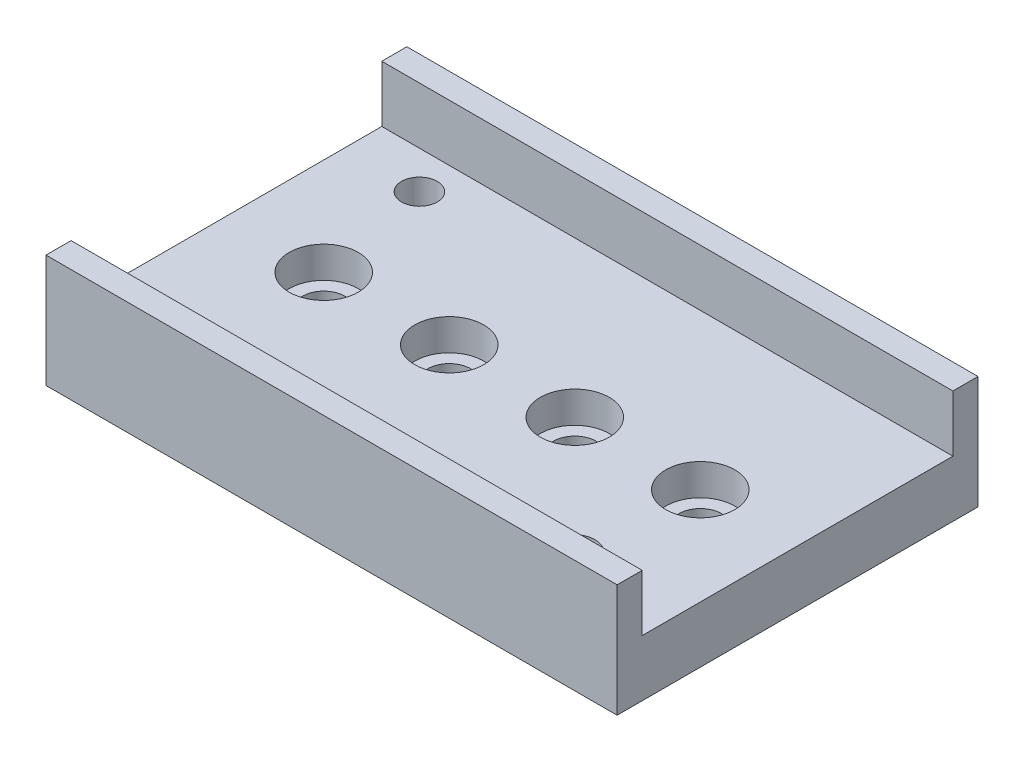
from build123d import *

# Parameters (mm, degrees)
SKETCH1_W           = 45.5
SKETCH1_H           = 28.75
SKETCH1_R           = 1.7
BOSS_EXTRUDE1_DEPTH = 2
BOSS_EXTRUDE2_DEPTH = 7
SKETCH3_W           = 45.5
SKETCH3_H           = 8
SKETCH3_R           = 1.425
SKETCH3_R_2         = 1.685028189
BOSS_EXTRUDE3_DEPTH = 2.5
CUT_EXTRUDE1_REACH  = 29.807


with BuildPart() as part:
    # Sketch1 → Boss-Extrude1 (new body)
    with BuildSketch(Plane(origin=(0, 0, 0), x_dir=(1, 0, 0), z_dir=(0, 1, 0))):
        Rectangle(SKETCH1_W, SKETCH1_H)
        with Locations(Location((-15, 0, 0), (0, 0, 270))):
            Circle(SKETCH1_R, mode=Mode.SUBTRACT)
        with Locations(Location((-5, 0, 0), (0, 0, 270))):
            Circle(SKETCH1_R, mode=Mode.SUBTRACT)
        with Locations(Location((5, 0, 0), (0, 0, 270))):
            Circle(SKETCH1_R, mode=Mode.SUBTRACT)
        with Locations(Location((15, 0, 0), (0, 0, 270))):
            Circle(SKETCH1_R, mode=Mode.SUBTRACT)
    extrude(amount=BOSS_EXTRUDE1_DEPTH)

    # Sketch2 → Boss-Extrude2 (add)
    with BuildSketch(Plane(origin=(0, 2, 0), x_dir=(1, 0, 0), z_dir=(0, 1, 0))):
        Polygon((-22.75, 14.375), (22.75, 14.375), (22.75, 12.375), (20.75, 12.375), (-20.75, 12.375), (-22.75, 12.375), align=None)
        Polygon((-22.75, -14.375), (22.75, -14.375), (22.75, -12.375), (20.75, -12.375), (-20.75, -12.375), (-22.75, -12.375), align=None)
    extrude(amount=BOSS_EXTRUDE2_DEPTH)

    # Sketch3 → Boss-Extrude3 (add)
    # profile 1 of 4: a face of its own
    with BuildSketch(Plane(origin=(0, 2, 0), x_dir=(1, 0, 0), z_dir=(0, 1, 0))):
        with Locations((0, 8.375)):
            Rectangle(SKETCH3_W, SKETCH3_H)
        with Locations(Location((-16.75, 9.375, 0), (0, 0, 270))):
            Circle(SKETCH3_R, mode=Mode.SUBTRACT)
    # profile 2 of 4: a face of its own
    with BuildSketch(Plane(origin=(0, 2, 0), x_dir=(1, 0, 0), z_dir=(0, 1, 0))):
        with BuildLine():
            Line((22.75, 4.375), (-22.75, 4.375))
            Line((-22.75, 4.375), (-22.75, 0))
            Line((-22.75, 0), (-17.75, 0))
            ThreePointArc((-17.75, 0), (-15, 2.75), (-12.25, 0))
            Line((-12.25, 0), (-7.75, 0))
            ThreePointArc((-7.75, 0), (-5, 2.75), (-2.25, 0))
            Line((-2.25, 0), (2.25, 0))
            ThreePointArc((2.25, 0), (5, 2.75), (7.75, 0))
            Line((7.75, 0), (12.25, 0))
            ThreePointArc((12.25, 0), (15, 2.75), (17.75, 0))
            Line((17.75, 0), (22.75, 0))
            Line((22.75, 0), (22.75, 4.375))
        make_face()
    # profile 3 of 4: a face of its own
    with BuildSketch(Plane(origin=(0, 2, 0), x_dir=(1, 0, 0), z_dir=(0, 1, 0))):
        with BuildLine():
            Line((-17.75, 0), (-22.75, 0))
            Line((-22.75, 0), (-22.75, -4.375))
            Line((-22.75, -4.375), (22.75, -4.375))
            Line((22.75, -4.375), (22.75, 0))
            Line((22.75, 0), (17.75, 0))
            ThreePointArc((17.75, 0), (15, -2.75), (12.25, 0))
            Line((12.25, 0), (7.75, 0))
            ThreePointArc((7.75, 0), (5, -2.75), (2.25, 0))
            Line((2.25, 0), (-2.25, 0))
            ThreePointArc((-2.25, 0), (-5, -2.75), (-7.75, 0))
            Line((-7.75, 0), (-12.25, 0))
            ThreePointArc((-12.25, 0), (-15, -2.75), (-17.75, 0))
        make_face()
    # profile 4 of 4: a face of its own
    with BuildSketch(Plane(origin=(0, 2, 0), x_dir=(1, 0, 0), z_dir=(0, 1, 0))):
        with Locations((0, -8.375)):
            Rectangle(SKETCH3_W, SKETCH3_H)
        with Locations(Location((14.25, -9.325, 0), (0, 0, 270))):
            Circle(SKETCH3_R_2, mode=Mode.SUBTRACT)
    extrude(amount=BOSS_EXTRUDE3_DEPTH)

    # Sketch4 → Cut-Extrude1 (cut, up to next)
    with BuildSketch(Plane(origin=(0, 2, 0), x_dir=(1, 0, 0), z_dir=(0, 1, 0)), mode=Mode.PRIVATE) as cut_extrude1_sk1:
        Polygon((-19.867691454, 9.375), (-18.308845727, 6.675), (-15.191154273, 6.675), (-13.632308546, 9.375), (-15.191154273, 12.075), (-18.308845727, 12.075), align=None)
    cut_extrude1_tool1 = extrude(cut_extrude1_sk1.sketch, amount=-CUT_EXTRUDE1_REACH, mode=Mode.PRIVATE) & part.part
    # Sketch4 → Cut-Extrude1 (cut, up to next)
    with BuildSketch(Plane(origin=(0, 2, 0), x_dir=(1, 0, 0), z_dir=(0, 1, 0)), mode=Mode.PRIVATE) as cut_extrude1_sk2:
        Polygon((14.495583037, -6.216995983), (11.681181084, -7.558316843), (11.435598047, -10.66632086), (14.004416963, -12.433004017), (16.818818916, -11.091683157), (17.064401953, -7.98367914), align=None)
    cut_extrude1_tool2 = extrude(cut_extrude1_sk2.sketch, amount=-CUT_EXTRUDE1_REACH, mode=Mode.PRIVATE) & part.part
    add(cut_extrude1_tool1.solids().sort_by_distance((-16.75, 2, -9.375))[0], mode=Mode.SUBTRACT)
    add(cut_extrude1_tool2.solids().sort_by_distance((14.25, 2, 9.325))[0], mode=Mode.SUBTRACT)


solid = part.part
